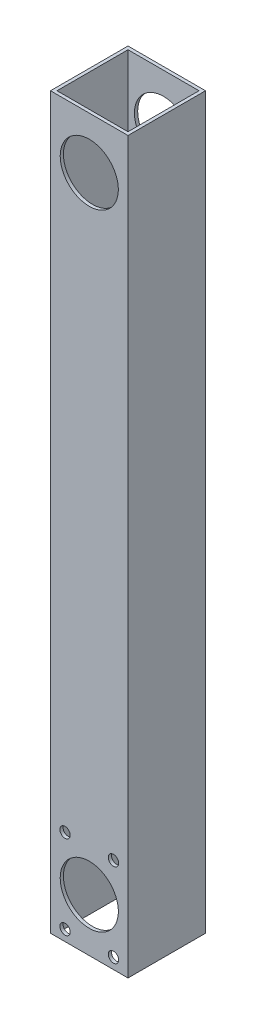
from build123d import *

# Parameters (mm, degrees)
SKETCH1_W           = 38.1
SKETCH1_H           = 38.1
SKETCH1_W_2         = 34.925
SKETCH1_H_2         = 34.925
BOSS_EXTRUDE1_DEPTH = 358.775
SKETCH2_R           = 14.2875
SKETCH2_R_2         = 2.5527
SKETCH2_R_3         = 14.294919975
CUT_EXTRUDE1_DEPTH  = 362.294911568


with BuildPart() as part:
    # Sketch1 → Boss-Extrude1 (new body)
    with BuildSketch(Plane(origin=(0, 0, 0), x_dir=(1, 0, 0), z_dir=(0, 1, 0))):
        Rectangle(SKETCH1_W, SKETCH1_H)
        Rectangle(SKETCH1_W_2, SKETCH1_H_2, mode=Mode.SUBTRACT)
    extrude(amount=BOSS_EXTRUDE1_DEPTH)

    # Sketch2 → Cut-Extrude1 (cut, through all)
    with BuildSketch(Plane(origin=(0, 0, -19.05), x_dir=(-1, 0, 0), z_dir=(0, 0, -1))):
        with Locations((0, 333.375)):
            Circle(SKETCH2_R)
        with Locations((-11.90625, 5.311170072)):
            Circle(SKETCH2_R_2)
        with Locations((-11.90625, 46.555629928)):
            Circle(SKETCH2_R_2)
        with Locations((11.90625, 46.555629928)):
            Circle(SKETCH2_R_2)
        with Locations((11.90625, 5.311170072)):
            Circle(SKETCH2_R_2)
        with Locations((0, 25.9334)):
            Circle(SKETCH2_R_3)
    extrude(amount=-CUT_EXTRUDE1_DEPTH, mode=Mode.SUBTRACT)


solid = part.part
